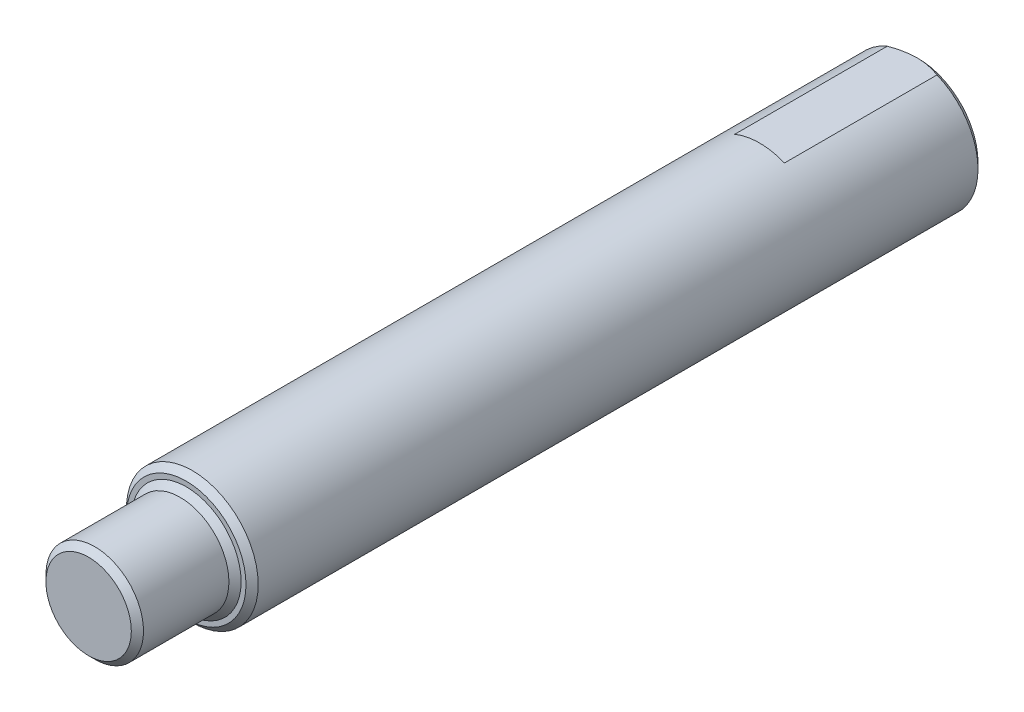
from build123d import *

# Parameters (mm, degrees)
SKETCH_1_R             = 5.4
EXTRUDE_1_DEPTH        = 60
CHAMFER_1_SIZE         = 0.5
SKETCH_2_R             = 4
EXTRUDE_2_DEPTH        = 8
CHAMFER_2_SIZE         = 0.5
HOLE_WIZARD_M5_1_D     = 4.2
HOLE_WIZARD_M5_1_DEPTH = 12.4
HOLE_WIZARD_M5_1_TIP   = 1.2618073
CHAMFER_3_SIZE         = 0.5
SKETCH_5_W             = 10
SKETCH_5_H             = 3
CUT_EXTRUDE_3_DEPTH    = 13
CHAMFER_4_SIZE         = 0.5


with BuildPart() as part:
    # 草图1 → 拉伸1 (new body)
    with BuildSketch(Plane.XY):
        Circle(SKETCH_1_R)
    extrude(amount=EXTRUDE_1_DEPTH)

    # 倒角1
    chamfer_1_edges = [part.edges().sort_by_distance(p)[0] for p in [
        (-5.4, 0, 0),
        (-5.4, 0, 60),
    ]]
    chamfer(chamfer_1_edges, length=CHAMFER_1_SIZE)

    # 草图2 → 拉伸2 (add)
    with BuildSketch(Plane.XY.offset(60)):
        Circle(SKETCH_2_R)
    extrude(amount=EXTRUDE_2_DEPTH)

    # 倒角2
    chamfer_2_edges = [part.edges().sort_by_distance(p)[0] for p in [
        (-4, 0, 68),
    ]]
    chamfer(chamfer_2_edges, length=CHAMFER_2_SIZE)

    # M5 螺纹孔1
    with Locations(Plane(origin=(0, 0, 0), x_dir=(-1, 0, 0), z_dir=(0, 0, -1))):
        with Locations((0, 0)):
            Hole(HOLE_WIZARD_M5_1_D / 2, depth=HOLE_WIZARD_M5_1_DEPTH)
            with Locations((0, 0, -(HOLE_WIZARD_M5_1_DEPTH + HOLE_WIZARD_M5_1_TIP / 2))):  # 118° drill point
                Cone(0, HOLE_WIZARD_M5_1_D / 2, HOLE_WIZARD_M5_1_TIP, mode=Mode.SUBTRACT)

    # 倒角3
    chamfer_3_edges = [part.edges().sort_by_distance(p)[0] for p in [
        (-2.1, 0, 0),
    ]]
    chamfer(chamfer_3_edges, length=CHAMFER_3_SIZE)

    # 草图5 → 拉伸3 (cut)
    with BuildSketch(Plane.XY):
        with Locations((0, 6.5)):
            Rectangle(SKETCH_5_W, SKETCH_5_H)
    cut_extrude_3 = extrude(amount=CUT_EXTRUDE_3_DEPTH, mode=Mode.SUBTRACT)

    # 镜向1: 拉伸3 across plane
    add(cut_extrude_3.mirror(Plane.ZX), mode=Mode.SUBTRACT)

    # 倒角4
    chamfer_4_edges = [part.edges().sort_by_distance(p)[0] for p in [
        (-4, 0, 60),
    ]]
    chamfer(chamfer_4_edges, length=CHAMFER_4_SIZE)


solid = part.part
